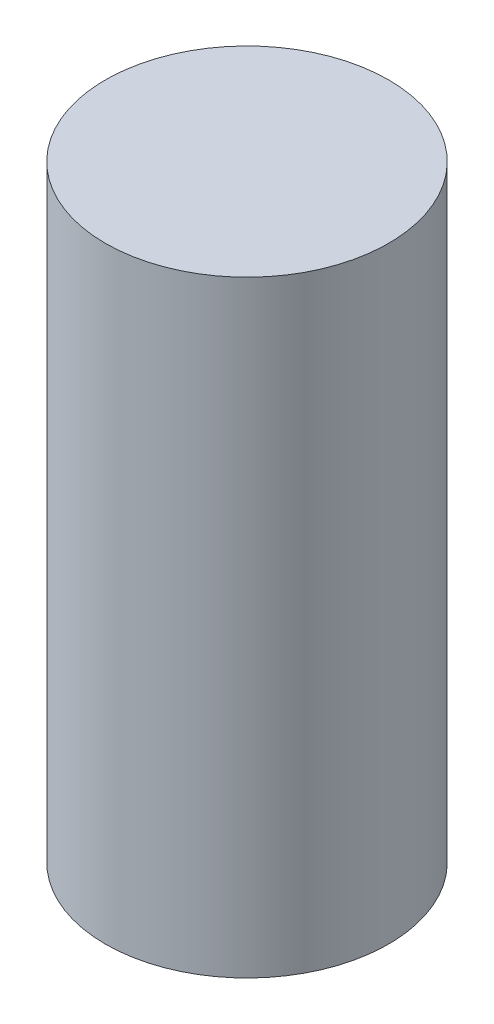
from build123d import *

# Parameters (mm, degrees)
SKETCH1_R           = 0.875
BOSS_EXTRUDE1_DEPTH = 3.75


with BuildPart() as part:
    # Sketch1 → Boss-Extrude1 (new body)
    with BuildSketch(Plane(origin=(0, 0, 0), x_dir=(1, 0, 0), z_dir=(0, 1, 0))):
        with Locations(Location((0, 0, 0), (0, 0, 270))):
            Circle(SKETCH1_R)
    extrude(amount=BOSS_EXTRUDE1_DEPTH)


solid = part.part
